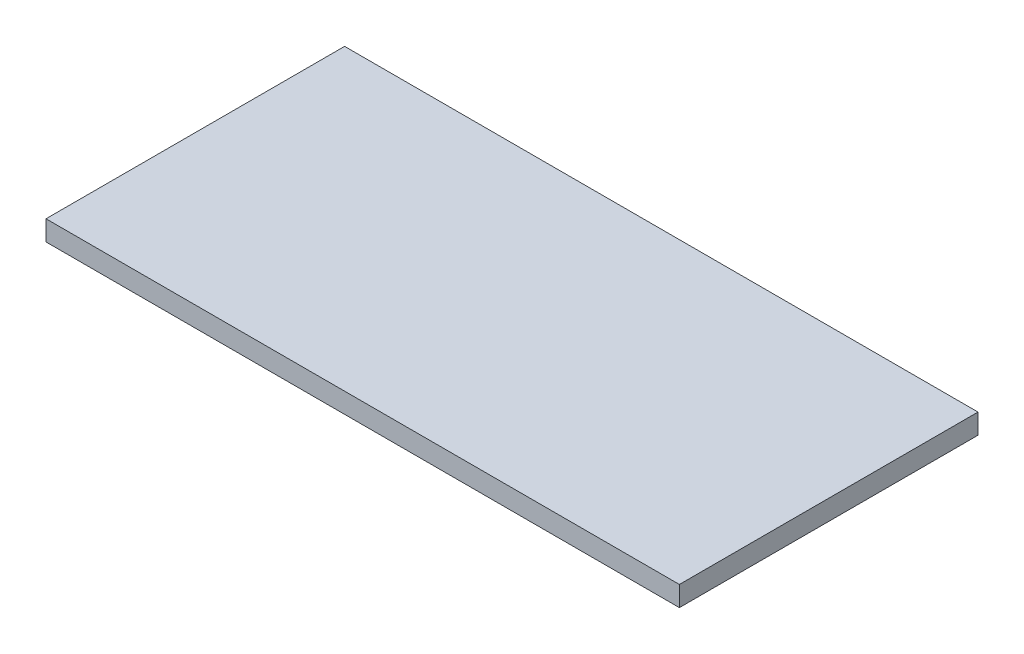
from build123d import *

# Parameters (mm, degrees)
SKETCH1_W           = 94.6
SKETCH1_H           = 44.6
BOSS_EXTRUDE1_DEPTH = 3


with BuildPart() as part:
    # Sketch1 → Boss-Extrude1 (new body)
    with BuildSketch(Plane(origin=(0, 0, 0), x_dir=(1, 0, 0), z_dir=(0, 1, 0))):
        Rectangle(SKETCH1_W, SKETCH1_H)
    extrude(amount=BOSS_EXTRUDE1_DEPTH)


solid = part.part
